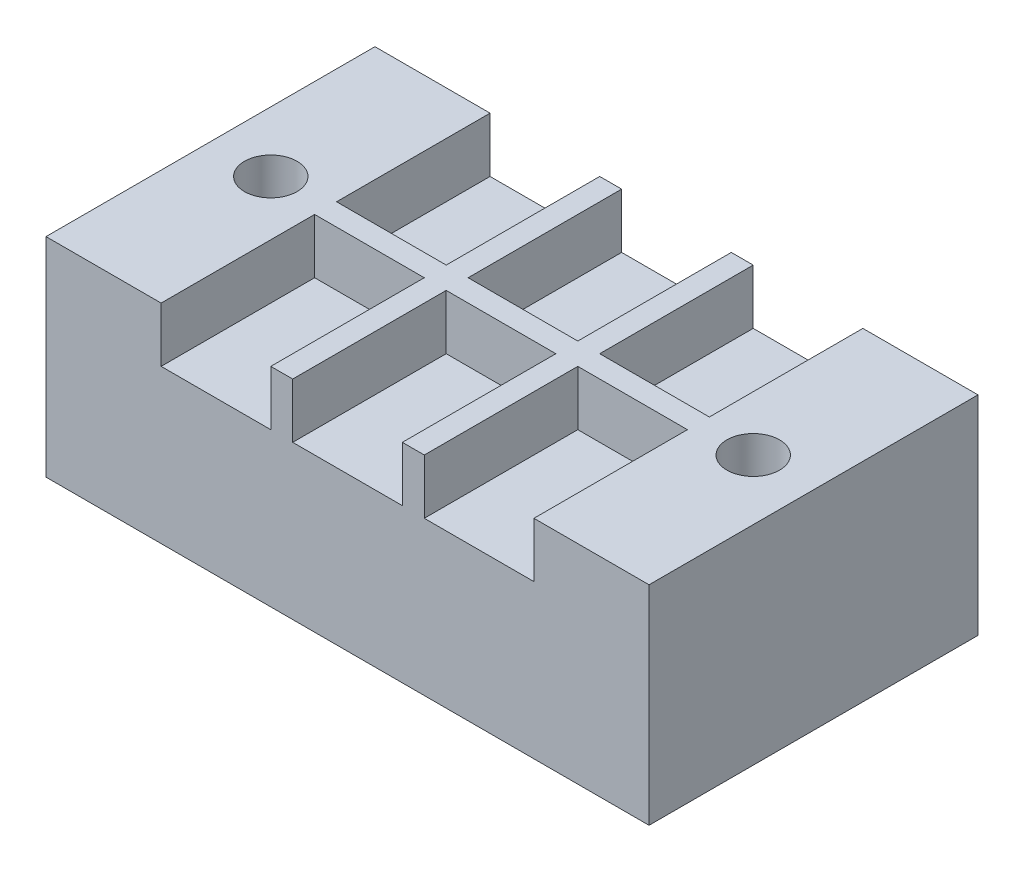
from build123d import *

# Parameters (mm, degrees)
SKETCH_1_W          = 55
SKETCH_1_H          = 30
EXTRUDE_1_DEPTH     = 19
SKETCH_2_R          = 2.4
CUT_EXTRUDE_1_DEPTH = 37.636730203
SKETCH_3_W          = 10
SKETCH_3_H          = 14
CUT_EXTRUDE_2_DEPTH = 5


with BuildPart() as part:
    # 草图1 → 凸台-拉伸1 (new body)
    with BuildSketch(Plane(origin=(0, 0, 0), x_dir=(1, 0, 0), z_dir=(0, 1, 0))):
        Rectangle(SKETCH_1_W, SKETCH_1_H)
    extrude(amount=EXTRUDE_1_DEPTH)

    # 草图2 → 切除-拉伸1 (cut, through all)
    with BuildSketch(Plane(origin=(0, 19, 0), x_dir=(1, 0, 0), z_dir=(0, 1, 0))):
        with Locations(Location((-22, 0, 0), (0, 0, 270))):
            Circle(SKETCH_2_R)
        with Locations(Location((22, 0, 0), (0, 0, 90))):
            Circle(SKETCH_2_R)
    extrude(amount=-CUT_EXTRUDE_1_DEPTH, mode=Mode.SUBTRACT)

    # 草图3 → 切除-拉伸2 (cut)
    with BuildSketch(Plane(origin=(0, 19, 0), x_dir=(1, 0, 0), z_dir=(0, 1, 0))):
        with Locations((-12, 8)):
            Rectangle(SKETCH_3_W, SKETCH_3_H)
        with Locations((0, 8)):
            Rectangle(SKETCH_3_W, SKETCH_3_H)
        with Locations((12, 8)):
            Rectangle(SKETCH_3_W, SKETCH_3_H)
        with Locations((12, -8)):
            Rectangle(SKETCH_3_W, SKETCH_3_H)
        with Locations((0, -8)):
            Rectangle(SKETCH_3_W, SKETCH_3_H)
        with Locations((-12, -8)):
            Rectangle(SKETCH_3_W, SKETCH_3_H)
    extrude(amount=-CUT_EXTRUDE_2_DEPTH, mode=Mode.SUBTRACT)


solid = part.part
